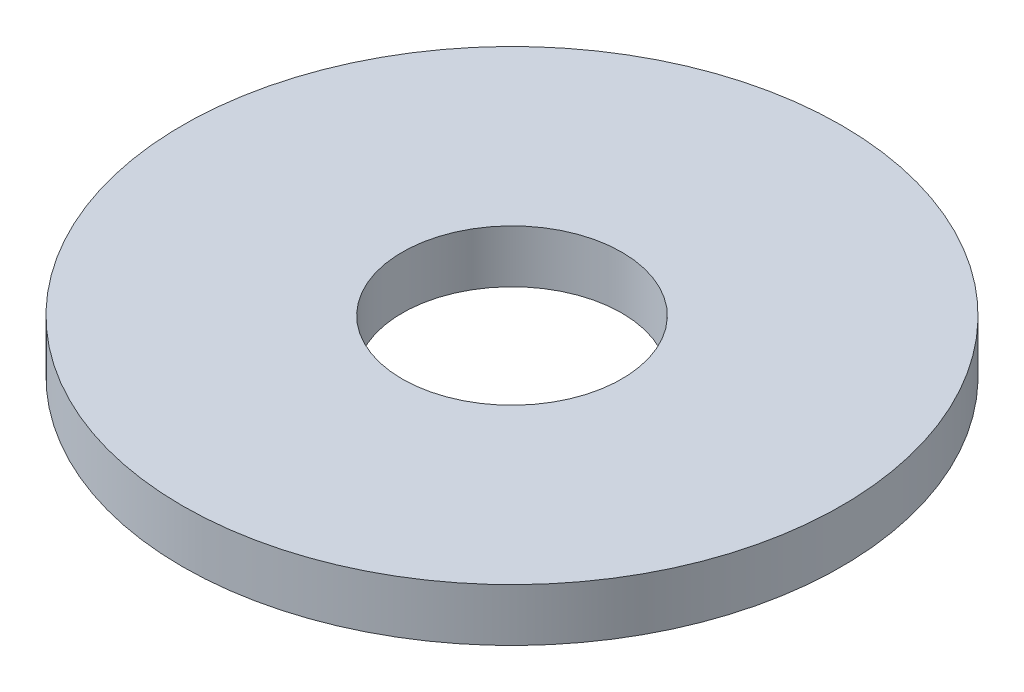
from build123d import *

# Parameters (mm, degrees)
SKETCH_1_R      = 7.5
SKETCH_1_R_2    = 2.5
EXTRUDE_1_DEPTH = 1.2


with BuildPart() as part:
    # 草图1 → 凸台-拉伸1 (new body)
    with BuildSketch(Plane(origin=(0, 0, 0), x_dir=(1, 0, 0), z_dir=(0, 1, 0))):
        with Locations(Location((0, 0, 0), (0, 0, 270))):
            Circle(SKETCH_1_R)
        with Locations(Location((0, 0, 0), (0, 0, 270))):
            Circle(SKETCH_1_R_2, mode=Mode.SUBTRACT)
    extrude(amount=EXTRUDE_1_DEPTH)


solid = part.part
